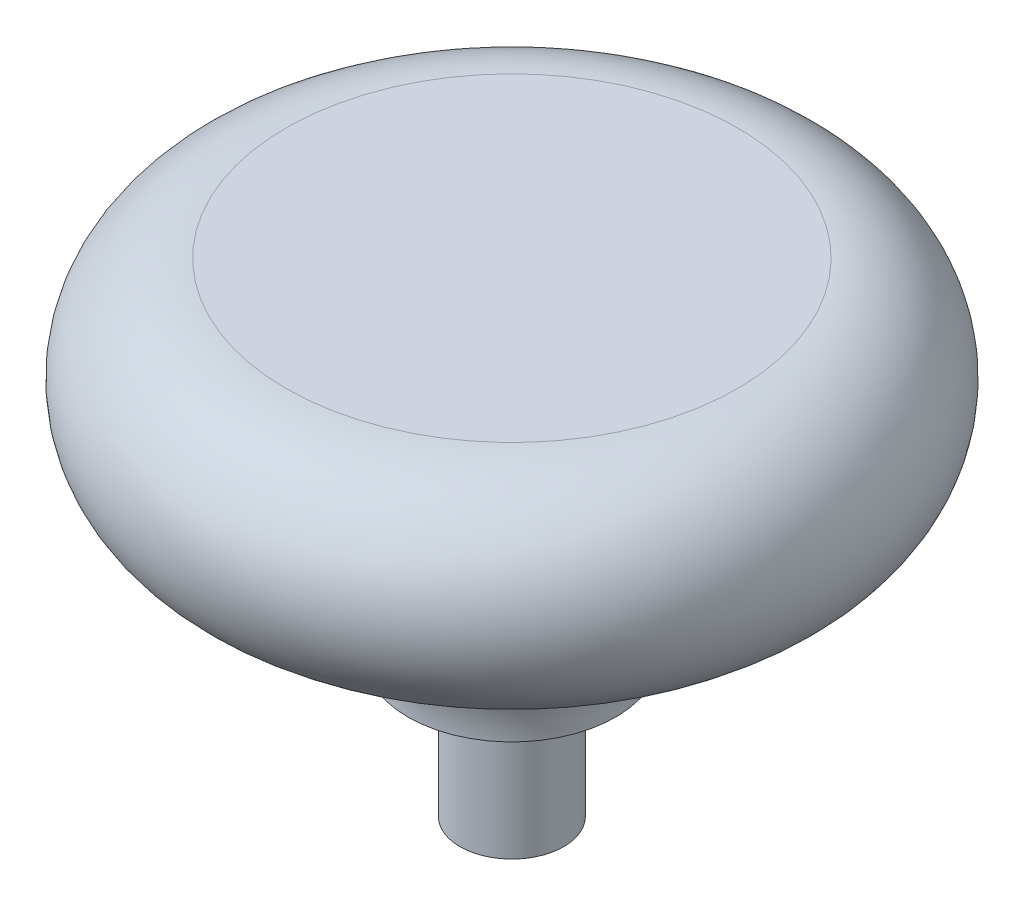
from build123d import *


with BuildPart() as part:
    # 스케치1 → 회전1 (revolve)
    with BuildSketch(Plane(origin=(0, 0, 0), x_dir=(-1, 0, 0), z_dir=(0, 0, -1)), mode=Mode.PRIVATE) as revolve_1_sk:
        with BuildLine():
            Line((-2.3876, 0), (0, 0))
            Line((0, 0), (0, 22.225))
            Line((0, 22.225), (-10.373857868, 22.225))
            ThreePointArc((-10.373857868, 22.225), (-15.146331518, 17.611139056), (-10.696351751, 12.685502283))
            ThreePointArc((-10.696351751, 12.685502283), (-6.485928162, 10.685857102), (-4.7752, 6.35))
            Line((-4.7752, 6.35), (-2.3876, 6.35))
            Line((-2.3876, 6.35), (-2.3876, 0))
        make_face()
    revolve(revolve_1_sk.sketch.rotate(Axis((0, 0, 0), (0, 1, 0)), 270), axis=Axis((0, 0, 0), (0, 1, 0)))


solid = part.part
